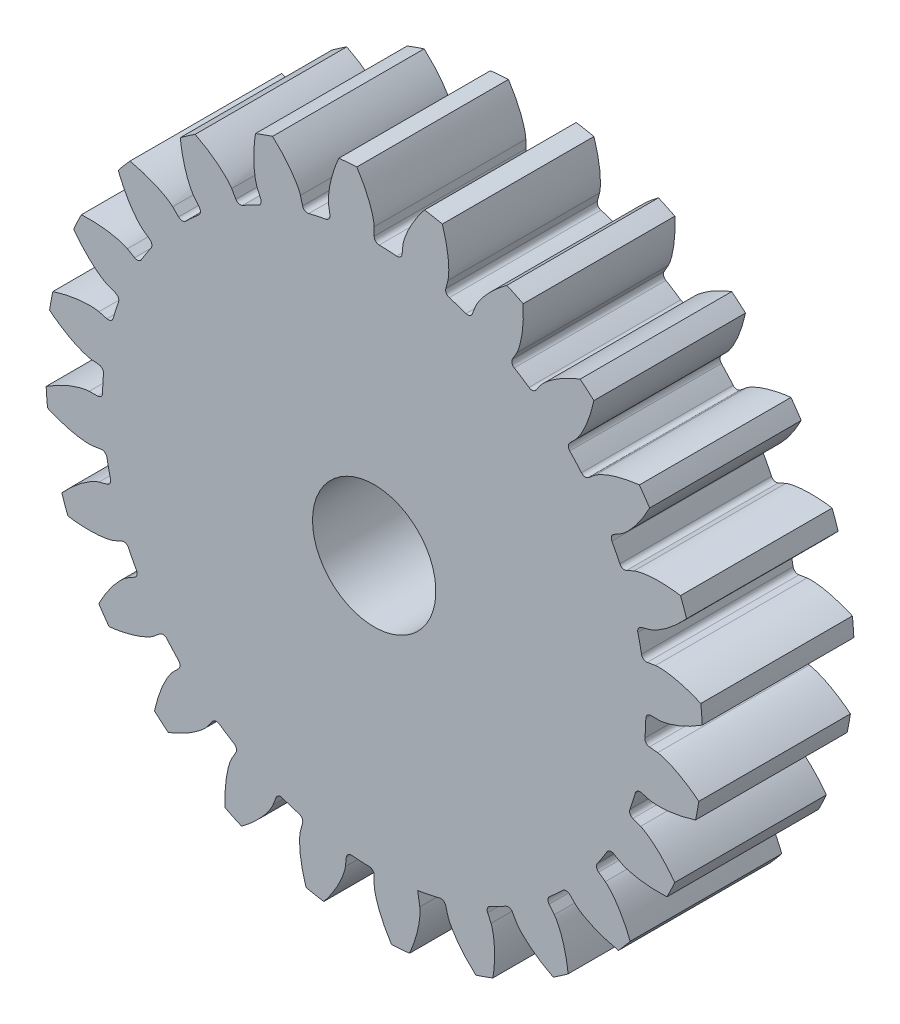
from build123d import *

# Parameters (mm, degrees)
SKETCH3_R           = 6.5
BOSS_EXTRUDE1_DEPTH = 3
CUT_EXTRUDE1_DEPTH  = 10.669539803
CIRPATTERN1_COUNT   = 24
FILLET1_R           = 0.1
SKETCH8_R           = 1.22
CUT_EXTRUDE2_DEPTH  = 10.657344829


with BuildPart() as part:
    # Sketch3 → Boss-Extrude1 (new body)
    with BuildSketch(Plane.XY):
        Circle(SKETCH3_R)
    extrude(amount=BOSS_EXTRUDE1_DEPTH)

    # Sketch4 → Cut-Extrude1 (cut, symmetric)
    with BuildSketch(Plane.XY):
        with BuildLine():
            Line((5.638155725, 0), (5.375, 0))
            ThreePointArc((5.375, 0), (5.368135319, -0.271566195), (5.34755881, -0.542438728))
            Line((5.34755881, -0.542438728), (5.609371036, -0.568996097))
            add(Edge.make_bspline(
                [(5.609371036, -0.568996097), (5.614742692, -0.56961917), (5.624845006, -0.57124474), (5.641258933, -0.574379645), (5.673442653, -0.581797105), (5.709503675, -0.591856766), (5.749880538, -0.604862521), (5.792887695, -0.620475112), (5.829401702, -0.634834019), (5.865572026, -0.650093088), (5.901364343, -0.666134175), (5.944421862, -0.68655251), (5.995626734, -0.712405396), (6.054815985, -0.744601031), (6.121132998, -0.783436936), (6.187795347, -0.825471252), (6.252611433, -0.868841205), (6.317148823, -0.914939296), (6.366684377, -0.952003573), (6.401327638, -0.97917287), (6.41995067, -0.994035388), (6.423145853, -0.996592874)],
                knots=[0, 0, 0, 0, 0, 0.015083688, 0.02853182, 0.04661014, 0.092110525, 0.119476176, 0.146842496, 0.174208854, 0.201574956, 0.228941013, 0.256307345, 0.307035032, 0.361767352, 0.416499661, 0.471231937, 0.525964282, 0.580696616, 0.635428982, 0.646811093, 0.646811093, 0.646811093, 0.646811093, 0.646811093], degree=4))
            ThreePointArc((6.423145853, -0.996592874), (6.480757982, -0.499775929), (6.5, 0))
            ThreePointArc((6.5, 0), (6.497731733, 0.171704192), (6.490928514, 0.343288546))
            add(Edge.make_bspline(
                [(5.638155725, 0), (5.643562837, 7.7791e-05), (5.653777625, 0.000675549), (5.670424125, 0.002137975), (5.703192097, 0.006269622), (5.740084225, 0.012638688), (5.781567476, 0.02150326), (5.825930672, 0.03269591), (5.863707347, 0.04329656), (5.901232936, 0.054827458), (5.938461369, 0.067174532), (5.983359659, 0.08314331), (6.036912156, 0.103696672), (6.099048372, 0.129754627), (6.168946089, 0.161699626), (6.239510158, 0.196791857), (6.308372181, 0.233399228), (6.377232251, 0.272748934), (6.430255393, 0.304624915), (6.467463682, 0.328159347), (6.487491545, 0.341066571), (6.490928514, 0.343288546)],
                knots=[0, 0, 0, 0, 0, 0.015083688, 0.02853182, 0.04661014, 0.092110525, 0.119476176, 0.146842496, 0.174208854, 0.201574956, 0.228941013, 0.256307345, 0.307035032, 0.361767352, 0.416499661, 0.471231937, 0.525964282, 0.580696616, 0.635428982, 0.646811093, 0.646811093, 0.646811093, 0.646811093, 0.646811093], degree=4))
        make_face()
    cut_extrude1 = extrude(amount=CUT_EXTRUDE1_DEPTH, both=True, mode=Mode.SUBTRACT)

    # CirPattern1: Cut-Extrude1 ×24 about axis
    cirpattern1_axis = Axis((0, 0, 0), (0, 0, 1))
    for i in range(1, CIRPATTERN1_COUNT):
        add(cut_extrude1.rotate(cirpattern1_axis, i * 360 / CIRPATTERN1_COUNT), mode=Mode.SUBTRACT)

    # Fillet1
    fillet1_edges = [part.edges().sort_by_distance(p)[0] for p in [
        (3.143545123, 4.359902414, 1.5),
        (2.6875, 4.654886545, 1.5),
        (5.34755881, -0.542438728, 1.5),
        (1.908005641, 5.024951689, 1.5),
        (1.391152367, 5.191851316, 1.5),
        (5.375, 0, 1.5),
        (0.542438728, 5.34755881, 1.5),
        (0, 5.375, 1.5),
        (-0.860094488, 5.305738636, 1.5),
        (-1.391152367, 5.191851316, 1.5),
        (-2.204013687, 4.902341142, 1.5),
        (-2.6875, 4.654886545, 1.5),
        (-3.397732994, 4.1648572, 1.5),
        (-3.800698949, 3.800698949, 1.5),
        (-4.359902414, 3.143545123, 1.5),
        (-4.654886545, 2.6875, 1.5),
        (-5.024951689, 1.908005641, 1.5),
        (-5.191851316, 1.391152367, 1.5),
        (-5.34755881, 0.542438728, 1.5),
        (-5.375, 0, 1.5),
        (-5.305738636, -0.860094488, 1.5),
        (-5.191851316, -1.391152367, 1.5),
        (-4.902341142, -2.204013687, 1.5),
        (-4.654886545, -2.6875, 1.5),
        (-4.1648572, -3.397732994, 1.5),
        (-3.800698949, -3.800698949, 1.5),
        (5.305738636, 0.860094488, 1.5),
        (-3.143545123, -4.359902414, 1.5),
        (5.191851316, 1.391152367, 1.5),
        (-2.6875, -4.654886545, 1.5),
        (-1.908005641, -5.024951689, 1.5),
        (-1.391152367, -5.191851316, 1.5),
        (-0.542438728, -5.34755881, 1.5),
        (0, -5.375, 1.5),
        (0.90220403, -5.565503379, 1.5),
        (1.391152367, -5.191851316, 1.5),
        (2.204013687, -4.902341142, 1.5),
        (2.6875, -4.654886545, 1.5),
        (3.397732994, -4.1648572, 1.5),
        (3.800698949, -3.800698949, 1.5),
        (4.359902414, -3.143545123, 1.5),
        (4.654886545, -2.6875, 1.5),
        (5.024951689, -1.908005641, 1.5),
        (5.191851316, -1.391152367, 1.5),
        (4.902341142, 2.204013687, 1.5),
        (4.654886545, 2.6875, 1.5),
        (4.1648572, 3.397732994, 1.5),
        (3.800698949, 3.800698949, 1.5),
    ]]
    fillet(fillet1_edges, radius=FILLET1_R)

    # Sketch8 → Cut-Extrude2 (cut, through all)
    with BuildSketch(Plane(origin=(0, 0, 0), x_dir=(-1, 0, 0), z_dir=(0, 0, -1))):
        Circle(SKETCH8_R)
    extrude(amount=-CUT_EXTRUDE2_DEPTH, mode=Mode.SUBTRACT)


solid = part.part
